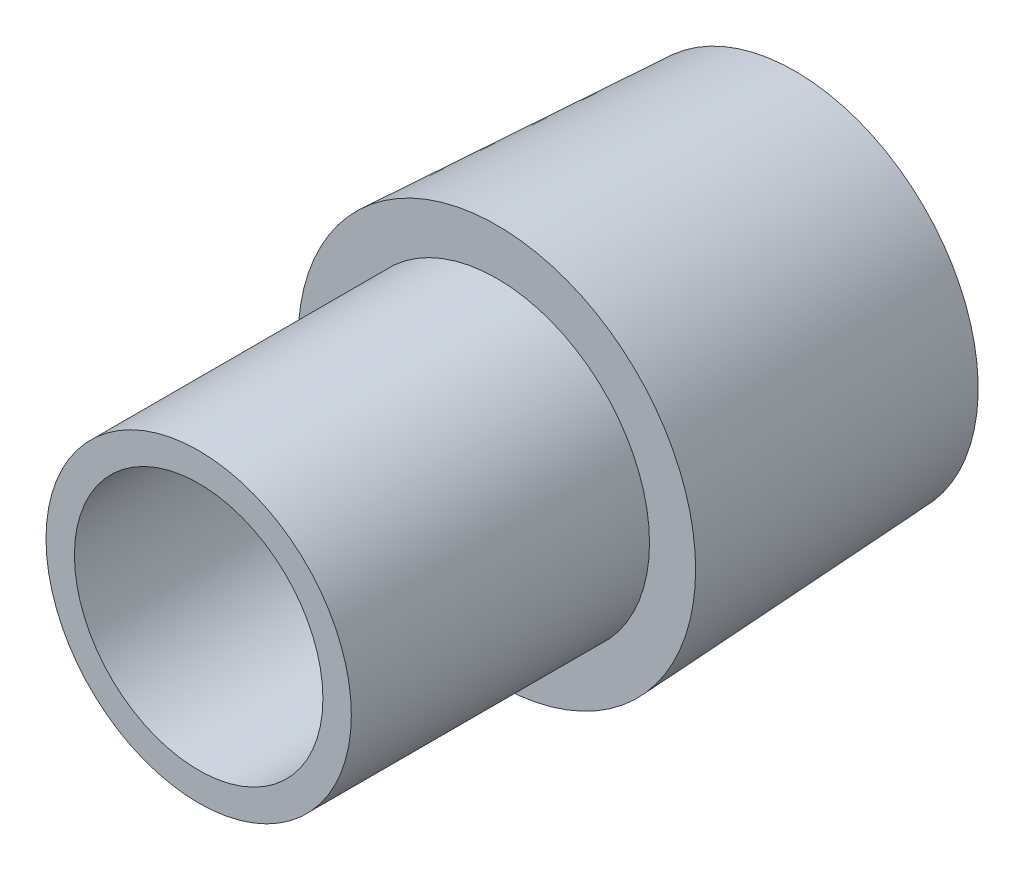
from build123d import *

# Parameters (mm, degrees)
SKETCH2_R           = 4.8768
SKETCH2_R_2         = 3.96875
BOSS_EXTRUDE1_DEPTH = 9.525
BOSS_EXTRUDE2_START = 9.525
SKETCH3_R           = 6.35
SKETCH3_R_2         = 3.96875
BOSS_EXTRUDE2_DEPTH = 9.525
DRAFT1_ANGLE        = -3


with BuildPart() as part:
    # Sketch2 → Boss-Extrude1 (new body)
    with BuildSketch(Plane.XY):
        with Locations(Location((0, 0, 0), (0, 0, 180))):
            Circle(SKETCH2_R)
        with Locations(Location((0, 0, 0), (0, 0, 180))):
            Circle(SKETCH2_R_2, mode=Mode.SUBTRACT)
    extrude(amount=BOSS_EXTRUDE1_DEPTH)

    # Sketch3 → Boss-Extrude2 (add)
    with BuildSketch(Plane(origin=(0, 0, 0), x_dir=(-1, 0, 0), z_dir=(0, 0, -1)).offset(BOSS_EXTRUDE2_START)):
        with Locations(Location((0, 0, 0), (0, 0, 180))):
            Circle(SKETCH3_R)
        Circle(SKETCH3_R_2, mode=Mode.SUBTRACT)
    extrude(amount=-BOSS_EXTRUDE2_DEPTH)

    # Draft1
    draft1_faces = [part.faces().sort_by_distance(p)[0] for p in [
        (-6.35, 0, -4.7625),
    ]]
    draft(draft1_faces, Plane.XY, DRAFT1_ANGLE)


solid = part.part
